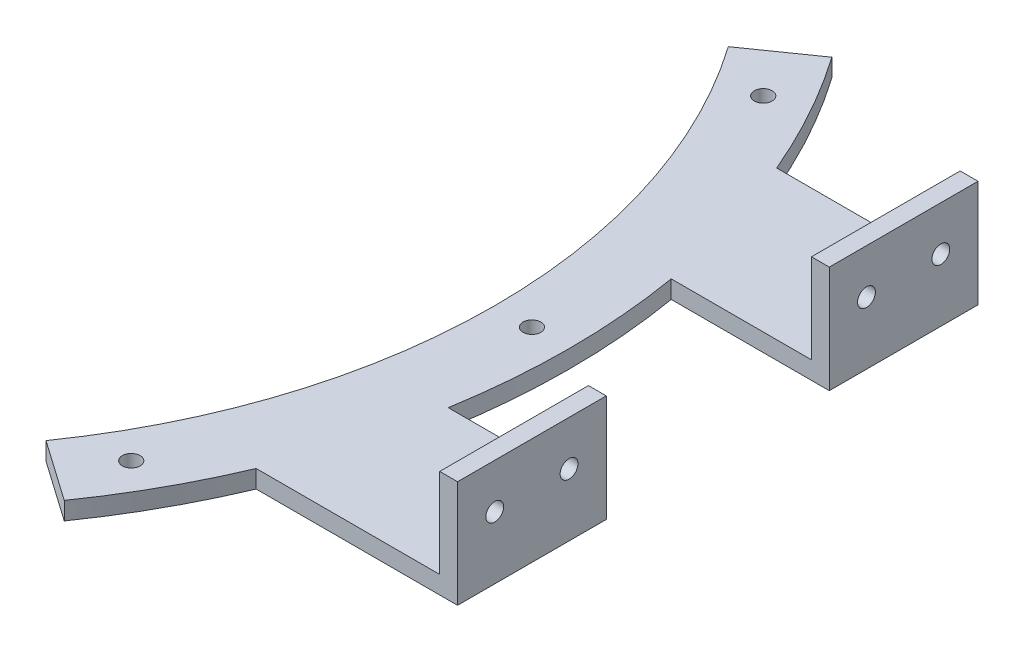
from build123d import *

# Parameters (mm, degrees)
SKETCH1_R           = 6
BOSS_EXTRUDE2_DEPTH = 12
SKETCH2_W           = 12
SKETCH2_H           = 100
BOSS_EXTRUDE3_DEPTH = 60
SKETCH3_R           = 6
CUT_EXTRUDE1_DEPTH  = 341.65676581


with BuildPart() as part:
    # Sketch1 → Boss-Extrude2 (new body)
    with BuildSketch(Plane(origin=(0, 0, 0), x_dir=(1, 0, 0), z_dir=(0, 1, 0))):
        with BuildLine():
            Line((550, 175), (550, 75))
            Line((550, 75), (443.705983732, 75))
            ThreePointArc((443.705983732, 75), (450, 0), (443.705983732, -75))
            Line((443.705983732, -75), (550, -75))
            Line((550, -75), (550, -175))
            Line((550, -175), (414.578098794, -175))
            ThreePointArc((414.578098794, -175), (393.796888861, -217.770545124), (368.61841993, -258.109396358))
            Line((368.61841993, -258.109396358), (327.660817716, -229.43057454))
            ThreePointArc((327.660817716, -229.43057454), (400, 0), (327.660817716, 229.43057454))
            Line((327.660817716, 229.43057454), (368.61841993, 258.109396358))
            ThreePointArc((368.61841993, 258.109396358), (393.796888861, 217.770545124), (414.578098794, 175))
            Line((414.578098794, 175), (550, 175))
        make_face()
        with Locations(Location((368.060796608, -212.5, 0), (0, 0, 270))):
            Circle(SKETCH1_R, mode=Mode.SUBTRACT)
        with Locations(Location((425, 0, 0), (0, 0, 270))):
            Circle(SKETCH1_R, mode=Mode.SUBTRACT)
        with Locations(Location((368.060796608, 212.5, 0), (0, 0, 270))):
            Circle(SKETCH1_R, mode=Mode.SUBTRACT)
    extrude(amount=BOSS_EXTRUDE2_DEPTH)

    # Sketch2 → Boss-Extrude3 (add)
    with BuildSketch(Plane(origin=(0, 12, 0), x_dir=(1, 0, 0), z_dir=(0, 1, 0))):
        with Locations((544, 125)):
            Rectangle(SKETCH2_W, SKETCH2_H)
        with Locations((544, -125)):
            Rectangle(SKETCH2_W, SKETCH2_H)
    extrude(amount=BOSS_EXTRUDE3_DEPTH)

    # Sketch3 → Cut-Extrude1 (cut, through all)
    with BuildSketch(Plane.ZY.offset(-538)):
        with Locations((-150, 42)):
            Circle(SKETCH3_R)
        with Locations((-100, 42)):
            Circle(SKETCH3_R)
        with Locations((100, 42)):
            Circle(SKETCH3_R)
        with Locations((150, 42)):
            Circle(SKETCH3_R)
    extrude(amount=-CUT_EXTRUDE1_DEPTH, mode=Mode.SUBTRACT)


solid = part.part
